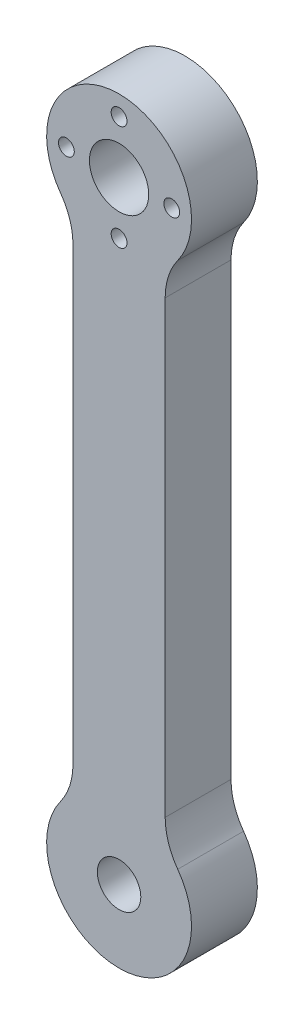
from build123d import *

# Parameters (mm, degrees)
ESQUISSE1_R        = 4.502635458
BOSS_EXTRU_1_DEPTH = 10
D_GAGEMENT_M21_D   = 2.4
CONG_1_R           = 10
D_GAGEMENT_M61_D   = 6.6


with BuildPart() as part:
    # Esquisse1 → Boss.-Extru.1 (new body)
    with BuildSketch(Plane.XY):
        with BuildLine():
            Line((-7, 38), (-7, -38))
            ThreePointArc((-7, -38), (0, -57.485281374), (7, -38))
            Line((7, -38), (7, 38))
            ThreePointArc((7, 38), (0, 57.485281374), (-7, 38))
        make_face()
        with Locations((0, 46.485281374)):
            Circle(ESQUISSE1_R, mode=Mode.SUBTRACT)
    extrude(amount=BOSS_EXTRU_1_DEPTH)

    # Dégagement M21 (through all)
    with Locations(Plane.XY.offset(10)):
        with Locations((-8, 46.485281374), (0, 54.485281374), (8, 46.485281374), (0, 38.485281374)):
            Hole(D_GAGEMENT_M21_D / 2)

    # Congé1
    cong_1_edges = [part.edges().sort_by_distance(p)[0] for p in [
        (7, 38, 5),
        (7, -38, 5),
        (-7, -38, 5),
        (-7, 38, 5),
    ]]
    fillet(cong_1_edges, radius=CONG_1_R)

    # Dégagement M61 (through all)
    with Locations(Plane.XY.offset(10)):
        with Locations((0, -46.485281374)):
            Hole(D_GAGEMENT_M61_D / 2)


solid = part.part
